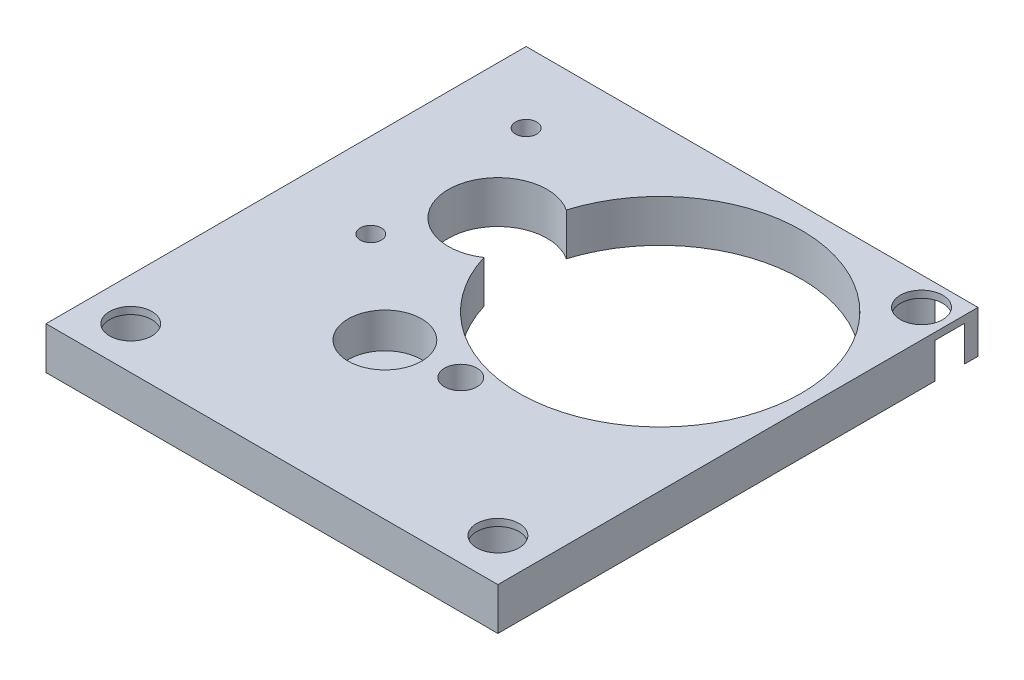
from build123d import *

# Parameters (mm, degrees)
SKETCH_1_W               = 32
SKETCH_1_H               = 34
SKETCH_1_R               = 2.6
EXTRUDE_1_DEPTH          = 2.5
EXTRUDE_START            = -0.5
SKETCH_1_28_W            = 32
SKETCH_1_28_H            = 34
EXTRUDE_2_DEPTH          = 0.5
SKETCH_2_R               = 1.5
CUT_EXTRUDE_1_DEPTH      = 30.983328701
SKETCH_2_3_R             = 2.25
CUT_EXTRUDE_2_DEPTH      = 2.5
SKETCH_3_R               = 0.75
CUT_EXTRUDE_3_DEPTH      = 30.983328701
CUT_EXTRUDE_4_DEPTH      = 30.93743476
CUT_EXTRUDE_4_DEPTH_BACK = 30.93743476
SKETCH_1_29_R            = 1.15


with BuildPart() as part:
    # 草图1 → 凸台-拉伸1 (new body)
    with BuildSketch(Plane(origin=(0, 0, 0), x_dir=(1, 0, 0), z_dir=(0, 1, 0))):
        with Locations((3, 6)):
            Rectangle(SKETCH_1_W, SKETCH_1_H)
        with Locations(Location((0, 0, 0), (0, 0, 270))):
            Circle(SKETCH_1_R, mode=Mode.SUBTRACT)
        with BuildLine():
            ThreePointArc((-1.554347826, 8.564938654), (-6.989130435, 11.48154906), (-1.554347826, 14.398159465))
            ThreePointArc((-1.554347826, 14.398159465), (18.010869565, 11.48154906), (-1.554347826, 8.564938654))
        make_face(mode=Mode.SUBTRACT)
    extrude(amount=EXTRUDE_1_DEPTH)

    # 草图1<28> → 凸台-拉伸2 (add)
    with BuildSketch(Plane(origin=(0, 0, 0), x_dir=(1, 0, 0), z_dir=(0, 1, 0)).offset(EXTRUDE_START)):
        with Locations((3, 6)):
            Rectangle(SKETCH_1_28_W, SKETCH_1_28_H)
        with BuildLine():
            ThreePointArc((-1.554347826, 8.564938654), (-6.989130435, 11.48154906), (-1.554347826, 14.398159465))
            ThreePointArc((-1.554347826, 14.398159465), (18.010869565, 11.48154906), (-1.554347826, 8.564938654))
        make_face(mode=Mode.SUBTRACT)
    extrude(amount=EXTRUDE_2_DEPTH)

    # 草图2 → 切除-拉伸1 (cut, through all)
    with BuildSketch(Plane.XZ.offset(0.5)):
        with Locations(Location((17, -21, 0), (0, 0, 270))):
            Circle(SKETCH_2_R)
        with Locations(Location((-10, 8, 0), (0, 0, 270))):
            Circle(SKETCH_2_R)
        with Locations(Location((16, 8, 0), (0, 0, 270))):
            Circle(SKETCH_2_R)
    extrude(amount=-CUT_EXTRUDE_1_DEPTH, mode=Mode.SUBTRACT)

    # 草图2<3> → 切除-拉伸2 (cut)
    with BuildSketch(Plane.XZ.offset(0.5)):
        with Locations((17, -21)):
            Circle(SKETCH_2_3_R)
        with Locations(Location((-10, 8, 0), (0, 0, 270))):
            Circle(SKETCH_2_3_R)
        with Locations(Location((16, 8, 0), (0, 0, 270))):
            Circle(SKETCH_2_3_R)
    extrude(amount=-CUT_EXTRUDE_2_DEPTH, mode=Mode.SUBTRACT)

    # 草图3 → 切除-拉伸3 (cut, through all)
    with BuildSketch(Plane.XZ.offset(0.5)):
        with Locations(Location((-7, -6, 0), (0, 0, 270))):
            Circle(SKETCH_3_R)
        with Locations(Location((-8, -18, 0), (0, 0, 270))):
            Circle(SKETCH_3_R)
    extrude(amount=-CUT_EXTRUDE_3_DEPTH, mode=Mode.SUBTRACT)

    # 草图1<29> → 切除-拉伸4 (cut, two sides: drawn at the far end of the back side and taken through both)
    with BuildSketch(Plane(origin=(0, 0, 0), x_dir=(1, 0, 0), z_dir=(0, 1, 0)).offset(-CUT_EXTRUDE_4_DEPTH_BACK)):
        with Locations(Location((4.985018819, 0.386765274, 0), (0, 0, 270))):
            Circle(SKETCH_1_29_R)
    extrude(amount=CUT_EXTRUDE_4_DEPTH + CUT_EXTRUDE_4_DEPTH_BACK, mode=Mode.SUBTRACT)


solid = part.part
